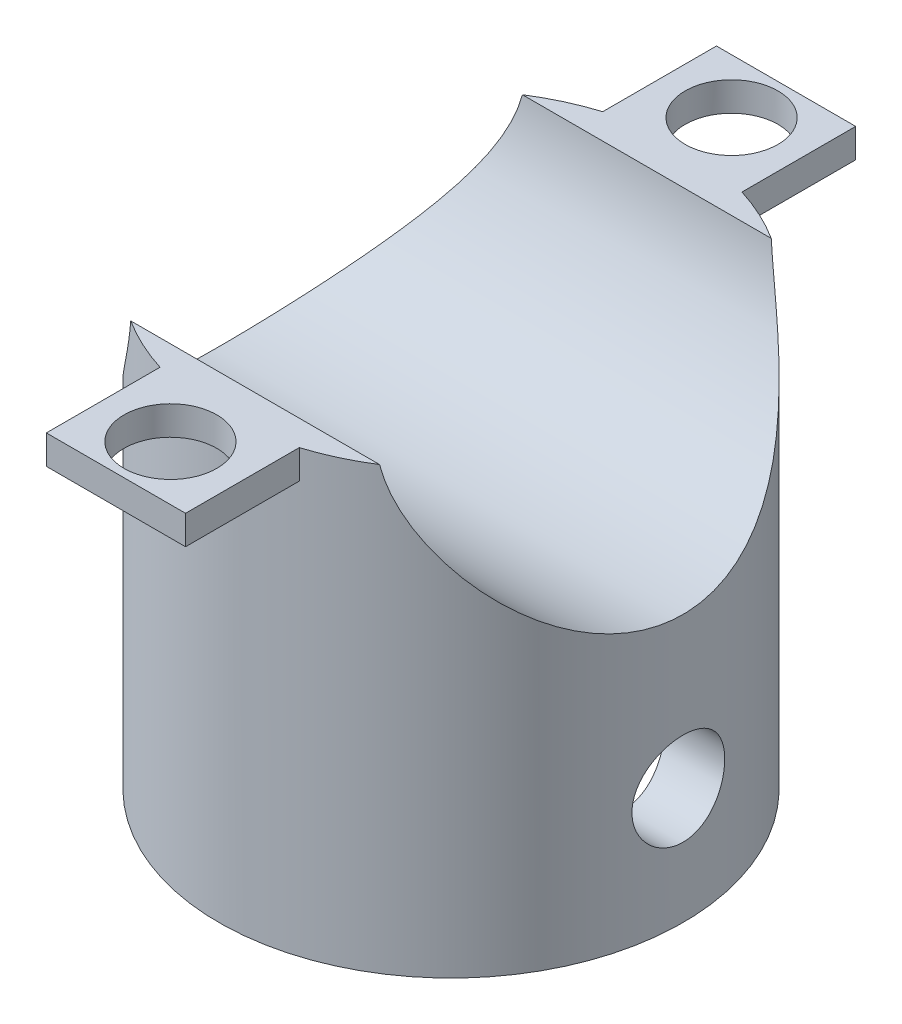
from build123d import *

# Parameters (mm, degrees)
SKETCH2_R                = 10
BOSS_EXTRUDE1_DEPTH      = 30
CUT_EXTRUDE1_START       = -10
SKETCH3_R                = 10
SKETCH3_R_2              = 7.5
CUT_EXTRUDE1_DEPTH       = 10
CUT_EXTRUDE3_DEPTH       = 10
CUT_EXTRUDE3_DEPTH_BACK  = 10
SKETCH5_R                = 2
FILLET2_R                = 10
BOSS_EXTRUDE2_START      = -67.5
SKETCH7_R                = 10
BOSS_EXTRUDE2_DEPTH      = 67.5
SKETCH8_R                = 50
SKETCH8_R_2              = 10
CUT_EXTRUDE6_DEPTH       = 107.770782567
SKETCH9_R                = 7.5
CUT_EXTRUDE7_DEPTH       = 10
CUT_EXTRUDE8_DEPTH       = 10
CUT_EXTRUDE8_DEPTH_BACK  = 10
SKETCH10_R               = 2
CUT_EXTRUDE9_START       = -60
SKETCH11_R               = 10
SKETCH11_R_2             = 7.5
CUT_EXTRUDE9_DEPTH       = 60
CUT_EXTRUDE10_START      = -60
SKETCH12_R               = 7.5
CUT_EXTRUDE10_DEPTH      = 60
CUT_EXTRUDE11_DEPTH      = 60
CUT_EXTRUDE11_DEPTH_BACK = 60
SKETCH14_R               = 8.5
CUT_EXTRUDE12_DEPTH      = 60
CUT_EXTRUDE12_DEPTH_BACK = 60
SKETCH15_W               = 22.666202576
SKETCH15_H               = 2
BOSS_EXTRUDE3_DEPTH      = 3
BOSS_EXTRUDE3_DEPTH_BACK = 3
SKETCH16_W               = 6
SKETCH16_H               = 1.25
SKETCH18_R               = 2
CUT_EXTRUDE13_DEPTH      = 6.5
CUT_EXTRUDE15_DEPTH      = 16.5
CUT_EXTRUDE15_DEPTH_BACK = 16.5
SKETCH19_W               = 29.449673214
SKETCH19_H               = 14.848126233


with BuildPart() as part:
    # Sketch1 → Revolve1 (revolve)
    with BuildSketch(Plane.XY):
        Polygon((50, 25), (0, 25), (0, 22.5), (45, 22.5), (45, -22.5), (0, -22.5), (0, -25), (50, -25), align=None)
    revolve(axis=Axis((0, -25, 0), (0, 1, 0)))

    # Sketch2 → Boss-Extrude1 (add)
    with BuildSketch(Plane(origin=(0, 25, 0), x_dir=(1, 0, 0), z_dir=(0, 1, 0))):
        with Locations(Location((0, 0, 0), (0, 0, 180))):
            Circle(SKETCH2_R)
    extrude(amount=BOSS_EXTRUDE1_DEPTH)

    # Sketch3 → Cut-Extrude1 (cut)
    with BuildSketch(Plane(origin=(0, 55, 0), x_dir=(1, 0, 0), z_dir=(0, 1, 0)).offset(CUT_EXTRUDE1_START)):
        with Locations(Location((0, 0, 0), (0, 0, 180))):
            Circle(SKETCH3_R)
        with Locations(Location((0, 0, 0), (0, 0, 180))):
            Circle(SKETCH3_R_2, mode=Mode.SUBTRACT)
    extrude(amount=CUT_EXTRUDE1_DEPTH, mode=Mode.SUBTRACT)

    # Sketch5 → Cut-Extrude3 (cut, two sides: drawn at the far end of the back side and taken through both)
    with BuildSketch(Plane(origin=(0, 0, 0), x_dir=(0, 0, -1), z_dir=(1, 0, 0)).offset(-CUT_EXTRUDE3_DEPTH_BACK)):
        with Locations(Location((0, 50, 0), (0, 0, 180))):
            Circle(SKETCH5_R)
    extrude(amount=CUT_EXTRUDE3_DEPTH + CUT_EXTRUDE3_DEPTH_BACK, mode=Mode.SUBTRACT)

    # Fillet2
    fillet2_edges = [part.edges().sort_by_distance(p)[0] for p in [
        (-50, 25, 0),
    ]]
    fillet(fillet2_edges, radius=FILLET2_R)

    # Sketch7 → Boss-Extrude2 (add)
    with BuildSketch(Plane(origin=(0, 45, 0), x_dir=(1, 0, 0), z_dir=(0, 1, 0)).offset(BOSS_EXTRUDE2_START)):
        with Locations(Location((0, 0, 0), (0, 0, 180))):
            Circle(SKETCH7_R)
    extrude(amount=BOSS_EXTRUDE2_DEPTH)

    # Sketch8 → Cut-Extrude6 (cut, through all)
    with BuildSketch(Plane(origin=(0, 55, 0), x_dir=(1, 0, 0), z_dir=(0, 1, 0))):
        Circle(SKETCH8_R)
        with Locations(Location((0, 0, 0), (0, 0, 180))):
            Circle(SKETCH8_R_2, mode=Mode.SUBTRACT)
    extrude(amount=-CUT_EXTRUDE6_DEPTH, mode=Mode.SUBTRACT)

    # Sketch9 → Cut-Extrude7 (cut)
    with BuildSketch(Plane.XZ.offset(25)):
        with Locations(Location((0, 0, 0), (0, 0, 180))):
            Circle(SKETCH9_R)
    extrude(amount=-CUT_EXTRUDE7_DEPTH, mode=Mode.SUBTRACT)

    # Sketch10 → Cut-Extrude8 (cut, two sides: drawn at the far end of the back side and taken through both)
    with BuildSketch(Plane(origin=(0, 0, 0), x_dir=(0, 0, -1), z_dir=(1, 0, 0)).offset(-CUT_EXTRUDE8_DEPTH_BACK)):
        with Locations(Location((0, -20, 0), (0, 0, 180))):
            Circle(SKETCH10_R)
    extrude(amount=CUT_EXTRUDE8_DEPTH + CUT_EXTRUDE8_DEPTH_BACK, mode=Mode.SUBTRACT)

    # Sketch11 → Cut-Extrude9 (cut)
    with BuildSketch(Plane(origin=(0, 55, 0), x_dir=(1, 0, 0), z_dir=(0, 1, 0)).offset(CUT_EXTRUDE9_START)):
        with Locations(Location((0, 0, 0), (0, 0, 180))):
            Circle(SKETCH11_R)
        Circle(SKETCH11_R_2, mode=Mode.SUBTRACT)
    extrude(amount=CUT_EXTRUDE9_DEPTH, mode=Mode.SUBTRACT)

    # Sketch12 → Cut-Extrude10 (cut)
    with BuildSketch(Plane(origin=(0, 55, 0), x_dir=(1, 0, 0), z_dir=(0, 1, 0)).offset(CUT_EXTRUDE10_START)):
        Circle(SKETCH12_R)
    extrude(amount=CUT_EXTRUDE10_DEPTH, mode=Mode.SUBTRACT)

    # Sketch13 → Revolve2 (revolve)
    with BuildSketch(Plane(origin=(0, 0, 0), x_dir=(0, 0, -1), z_dir=(1, 0, 0))):
        with BuildLine():
            Line((0, -15), (0, 5))
            ThreePointArc((0, 5), (-10, -5), (0, -15))
        make_face()
    revolve(axis=Axis((0, -15, 0), (0, 1, 0)))

    # Sketch14 → Cut-Extrude11 (cut, two sides: drawn at the far end of the back side and taken through both)
    with BuildSketch(Plane(origin=(0, 0, 0), x_dir=(0, 0, -1), z_dir=(1, 0, 0)).offset(-CUT_EXTRUDE11_DEPTH_BACK)):
        with Locations(Location((0, -5, 0), (0, 0, 180))):
            Circle(SKETCH14_R)
    extrude(amount=CUT_EXTRUDE11_DEPTH + CUT_EXTRUDE11_DEPTH_BACK, mode=Mode.SUBTRACT)

    # Sketch15 → Cut-Extrude12 (cut, two sides: drawn at the far end of the back side and taken through both)
    with BuildSketch(Plane(origin=(0, 0, 0), x_dir=(0, 0, -1), z_dir=(1, 0, 0)).offset(-CUT_EXTRUDE12_DEPTH_BACK)):
        with Locations((0, -5)):
            Rectangle(SKETCH15_W, SKETCH15_H)
    extrude(amount=CUT_EXTRUDE12_DEPTH + CUT_EXTRUDE12_DEPTH_BACK, mode=Mode.SUBTRACT)


with BuildPart() as cut_extrude12_piece_1:
    # of the separate pieces the step leaves, piece 1, a body of its own (cut_extrude12_pieces)
    add(part.part.solids().sort_by_distance((-10, -25, 0))[0])



with BuildPart() as cut_extrude12_piece_2:
    # of the separate pieces the step leaves, piece 2, a body of its own (cut_extrude12_pieces)
    add(part.part.solids().sort_by_distance((5.267826876, -4, 8.440971508))[0])


with BuildPart() as cut_extrude12_piece_1_1:
    add(cut_extrude12_piece_1.part)

    add(cut_extrude12_piece_2.part)  # Boss-Extrude3 merges Cut-Extrude12 piece 2
    # Sketch16 → Boss-Extrude3 (add, two sides: drawn at the far end of the back side and taken through both)
    with BuildSketch(Plane(origin=(0, 0, 0), x_dir=(0, 0, -1), z_dir=(1, 0, 0)).offset(-BOSS_EXTRUDE3_DEPTH_BACK)):
        with Locations((-11.440971508, -3.375)):
            Rectangle(SKETCH16_W, SKETCH16_H)
        with Locations((11.440971508, -3.375)):
            Rectangle(SKETCH16_W, SKETCH16_H)
        with Locations((11.440971508, -6.625)):
            Rectangle(SKETCH16_W, SKETCH16_H)
        with Locations((-11.440971508, -6.625)):
            Rectangle(SKETCH16_W, SKETCH16_H)
    extrude(amount=BOSS_EXTRUDE3_DEPTH + BOSS_EXTRUDE3_DEPTH_BACK)

    # Sketch18 → Cut-Extrude13 (cut)
    with BuildSketch(Plane(origin=(0, -2.75, 0), x_dir=(1, 0, 0), z_dir=(0, 1, 0))):
        with Locations(Location((0, 12.092279572, 0), (0, 0, 270))):
            Circle(SKETCH18_R)
        with Locations(Location((0, -12.092279572, 0), (0, 0, 270))):
            Circle(SKETCH18_R)
    extrude(amount=-CUT_EXTRUDE13_DEPTH, mode=Mode.SUBTRACT)

    # Sketch19 → Cut-Extrude15 (cut, two sides: drawn at the far end of the back side and taken through both)
    with BuildSketch(Plane(origin=(0, 0, 0), x_dir=(0, 0, -1), z_dir=(1, 0, 0)).offset(-CUT_EXTRUDE15_DEPTH_BACK)):
        with Locations((-0.022434936, 1.737788606)):
            Rectangle(SKETCH19_W, SKETCH19_H)
    extrude(amount=CUT_EXTRUDE15_DEPTH + CUT_EXTRUDE15_DEPTH_BACK, mode=Mode.SUBTRACT)


solid = cut_extrude12_piece_1_1.part
